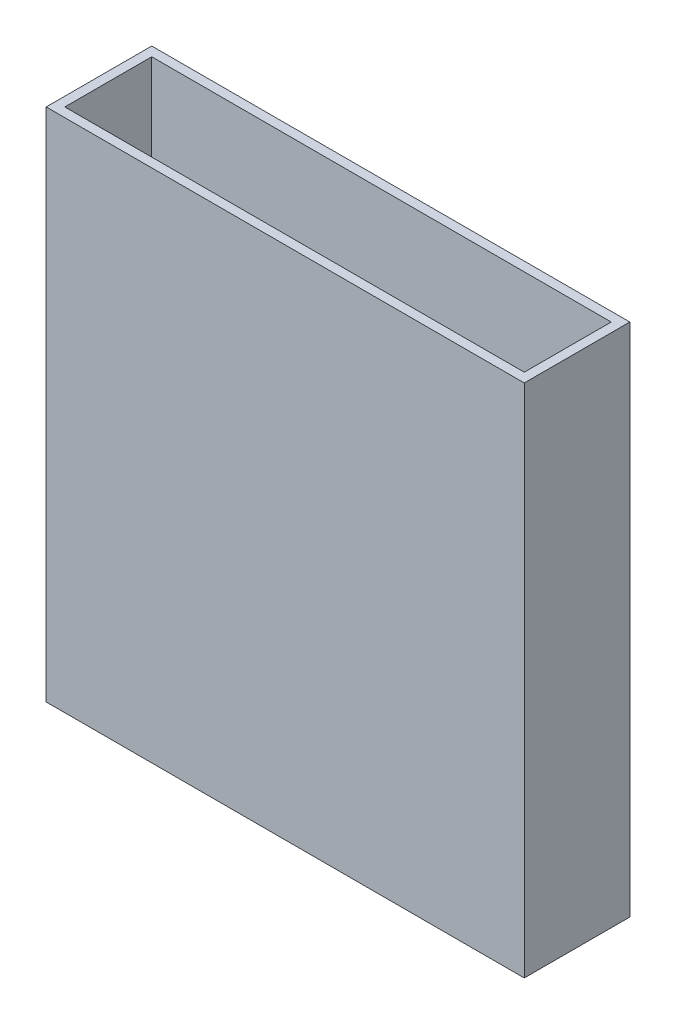
from build123d import *

# Parameters (mm, degrees)
ESQUISSE1_W             = 77
ESQUISSE1_H             = 17
BOSS_EXTRU_1_DEPTH      = 83
ESQUISSE2_W             = 74
ESQUISSE2_H             = 14
ENL_V_MAT_EXTRU_1_DEPTH = 80


with BuildPart() as part:
    # Esquisse1 → Boss.-Extru.1 (new body)
    with BuildSketch(Plane(origin=(0, 0, 0), x_dir=(1, 0, 0), z_dir=(0, 1, 0))):
        Rectangle(ESQUISSE1_W, ESQUISSE1_H)
    extrude(amount=BOSS_EXTRU_1_DEPTH)

    # Esquisse2 → Enlèv. mat.-Extru.1 (cut)
    with BuildSketch(Plane(origin=(0, 83, 0), x_dir=(1, 0, 0), z_dir=(0, 1, 0))):
        Rectangle(ESQUISSE2_W, ESQUISSE2_H)
    extrude(amount=-ENL_V_MAT_EXTRU_1_DEPTH, mode=Mode.SUBTRACT)


solid = part.part
